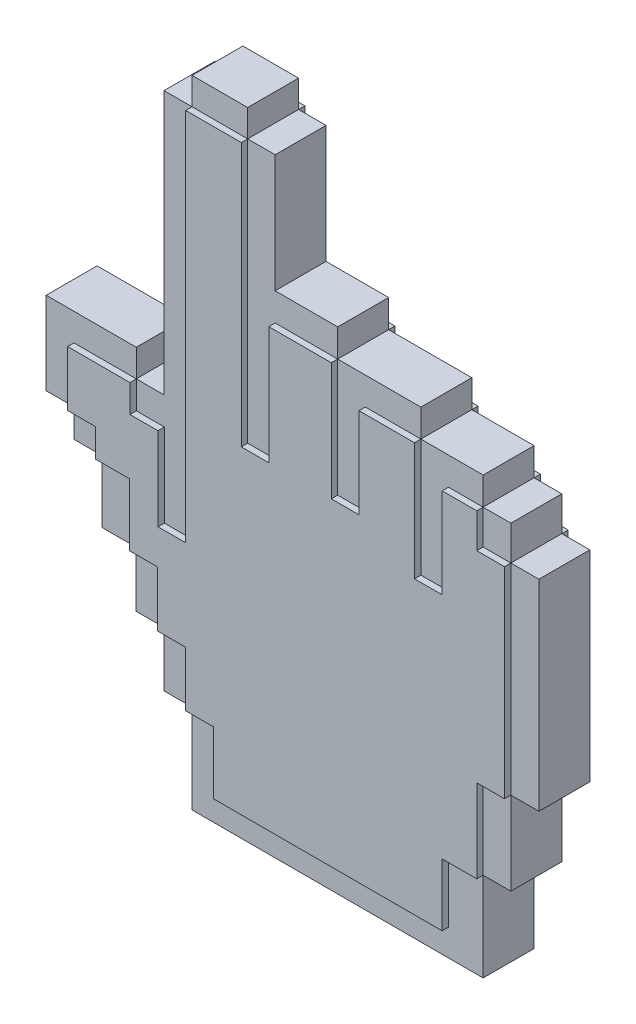
from build123d import *

# Parameters (mm, degrees)
BOSS_EXTRUDE1_DEPTH = 6.35
SKETCH1_4_W         = 5.585166648
SKETCH1_4_H         = 10.982596602
SKETCH1_4_W_2       = 5.534111201
SKETCH1_4_H_2       = 16.61114729
SKETCH1_4_H_3       = 11.076464949
SKETCH1_4_W_3       = 5.595450485
SKETCH1_4_H_4       = 40.116759918
SKETCH1_4_W_4       = 6.80545516
SKETCH1_4_H_5       = 12.437555982
SKETCH1_4_H_6       = 6.891111662
SKETCH1_4_H_7       = 5.632100821
SKETCH1_4_W_5       = 11.108414189
SKETCH1_4_H_8       = 5.424016142
BOSS_EXTRUDE2_DEPTH = 5.08


with BuildPart() as part:
    # Sketch1 → Boss-Extrude1 (new, symmetric)
    with BuildSketch(Plane.XY):
        Polygon((-21.349268481, -24.774385929), (-21.349268481, -35.756982531), (-15.795061386, -35.756982531), (-15.795061386, -48.199580791), (29.851375766, -48.199580791), (29.851375766, -35.756982531), (36.765931583, -35.756982531), (36.765931583, -19.145835241), (42.300042784, -19.145835241), (42.300042784, 20.970924677), (36.765931583, 20.970924677), (36.765931583, 27.862036339), (29.851375766, 27.862036339), (29.851375766, 9.897989881), (24.337202566, 9.897989881), (24.337202566, 33.41786203), (13.247182022, 33.41786203), (13.247182022, 15.422486478), (7.735264144, 15.422486478), (7.735264144, 38.947796151), (-4.751796061, 38.947796151), (-4.751796061, 15.422486478), (-10.240854292, 15.422486478), (-10.240854292, 68.024806454), (-21.349268481, 68.024806454), (-21.349268481, -6.713303634), (-26.874799511, -6.713303634), (-26.874799511, 9.897989881), (-32.473823981, 9.897989881), (-32.473823981, 15.422486478), (-44.910223585, 15.422486478), (-44.910223585, 4.371735823), (-39.325056937, 4.371735823), (-39.325056937, -1.260364998), (-32.519601777, -1.260364998), (-32.519601777, -13.69792098), (-26.934435129, -13.69792098), (-26.934435129, -24.774385929), align=None)
    extrude(amount=BOSS_EXTRUDE1_DEPTH, both=True)

    # Sketch1<4> → Boss-Extrude2 (add, symmetric)
    with BuildSketch(Plane.XY):
        Polygon((-21.349268481, -35.756982531), (-21.349268481, -53.531928868), (36.765931583, -53.531928868), (36.765931583, -35.756982531), (29.851375766, -35.756982531), (29.851375766, -48.199580791), (-15.795061386, -48.199580791), (-15.795061386, -35.756982531), align=None)
        with Locations((-24.141851805, -30.26568423)):
            Rectangle(SKETCH1_4_W, SKETCH1_4_H)
        with Locations((39.532987184, -27.451408886)):
            Rectangle(SKETCH1_4_W_2, SKETCH1_4_H_2)
        with Locations((-29.727018453, -19.236153455)):
            Rectangle(SKETCH1_4_W, SKETCH1_4_H_3)
        with Locations((45.097768027, 0.912544718)):
            Rectangle(SKETCH1_4_W_3, SKETCH1_4_H_4)
        with Locations((-35.922329357, -7.479142989)):
            Rectangle(SKETCH1_4_W_4, SKETCH1_4_H_5)
        with Locations((39.532987184, 24.416480508)):
            Rectangle(SKETCH1_4_W_2, SKETCH1_4_H_6)
        with Locations((-42.117640261, 1.555685412)):
            Rectangle(SKETCH1_4_W, SKETCH1_4_H_7)
        Polygon((29.851375766, 27.862036339), (36.765931583, 27.862036339), (36.765931583, 33.41786203), (24.337202566, 33.41786203), (24.337202566, 9.897989881), (29.851375766, 9.897989881), align=None)
        Polygon((-50.454609627, 4.371735823), (-44.910223585, 4.371735823), (-44.910223585, 15.422486478), (-32.473823981, 15.422486478), (-32.473823981, 20.888501361), (-50.454609627, 20.888501361), align=None)
        Polygon((13.247182022, 33.41786203), (24.337202566, 33.41786203), (24.337202566, 38.947796151), (7.735264144, 38.947796151), (7.735264144, 15.422486478), (13.247182022, 15.422486478), align=None)
        Polygon((-26.934435129, 15.422486478), (-32.473823981, 15.422486478), (-32.473823981, 9.897989881), (-26.874799511, 9.897989881), (-26.874799511, -6.713303634), (-21.349268481, -6.713303634), (-21.349268481, 68.024806454), (-26.934435129, 68.024806454), align=None)
        Polygon((-4.751796061, 38.947796151), (7.735264144, 38.947796151), (7.735264144, 44.510136865), (-4.751796061, 44.510136865), (-4.751796061, 68.024806454), (-10.240854292, 68.024806454), (-10.240854292, 15.422486478), (-4.751796061, 15.422486478), align=None)
        with Locations((-15.795061387, 70.736814525)):
            Rectangle(SKETCH1_4_W_5, SKETCH1_4_H_8)
    extrude(amount=BOSS_EXTRUDE2_DEPTH, both=True)


solid = part.part
